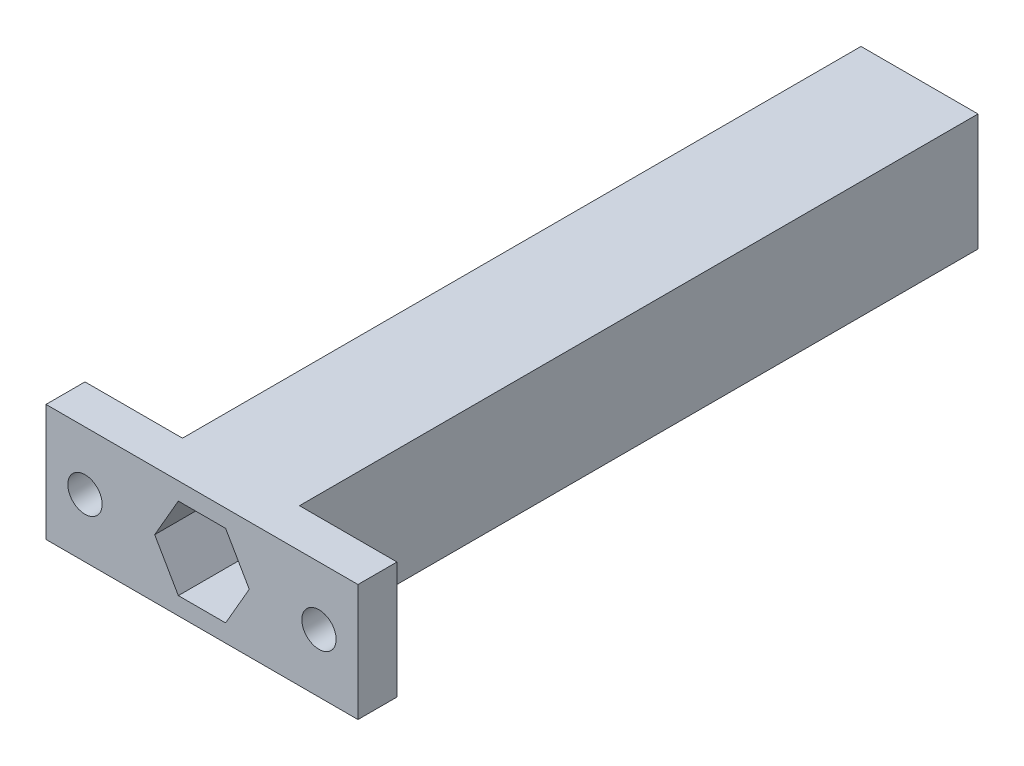
from build123d import *

# Parameters (mm, degrees)
SKETCH1_W           = 15
SKETCH1_H           = 15
SKETCH1_R           = 3.2
BOSS_EXTRUDE1_DEPTH = 92
SKETCH4_W           = 40
SKETCH4_H           = 15
SKETCH4_R           = 2.2
BOSS_EXTRUDE2_DEPTH = 5
CUT_EXTRUDE1_DEPTH  = 75


with BuildPart() as part:
    # Sketch1 → Boss-Extrude1 (new body)
    with BuildSketch(Plane.XY):
        with Locations((43.5, 26)):
            Rectangle(SKETCH1_W, SKETCH1_H)
        with Locations((43.5, 26)):
            Circle(SKETCH1_R, mode=Mode.SUBTRACT)
    extrude(amount=BOSS_EXTRUDE1_DEPTH)

    # Sketch4 → Boss-Extrude2 (add)
    with BuildSketch(Plane.XY.offset(92)):
        with Locations((43.5, 26)):
            Rectangle(SKETCH4_W, SKETCH4_H)
        with Locations((58.5, 26)):
            Circle(SKETCH4_R, mode=Mode.SUBTRACT)
        with Locations((28.5, 26)):
            Circle(SKETCH4_R, mode=Mode.SUBTRACT)
    extrude(amount=-BOSS_EXTRUDE2_DEPTH)

    # Sketch3 → Cut-Extrude1 (cut)
    with BuildSketch(Plane.XY.offset(92)):
        Polygon((40.468911087, 20.75), (46.531088913, 20.75), (49.562177826, 26), (46.531088913, 31.25), (40.468911087, 31.25), (37.437822174, 26), align=None)
    extrude(amount=-CUT_EXTRUDE1_DEPTH, mode=Mode.SUBTRACT)


solid = part.part
